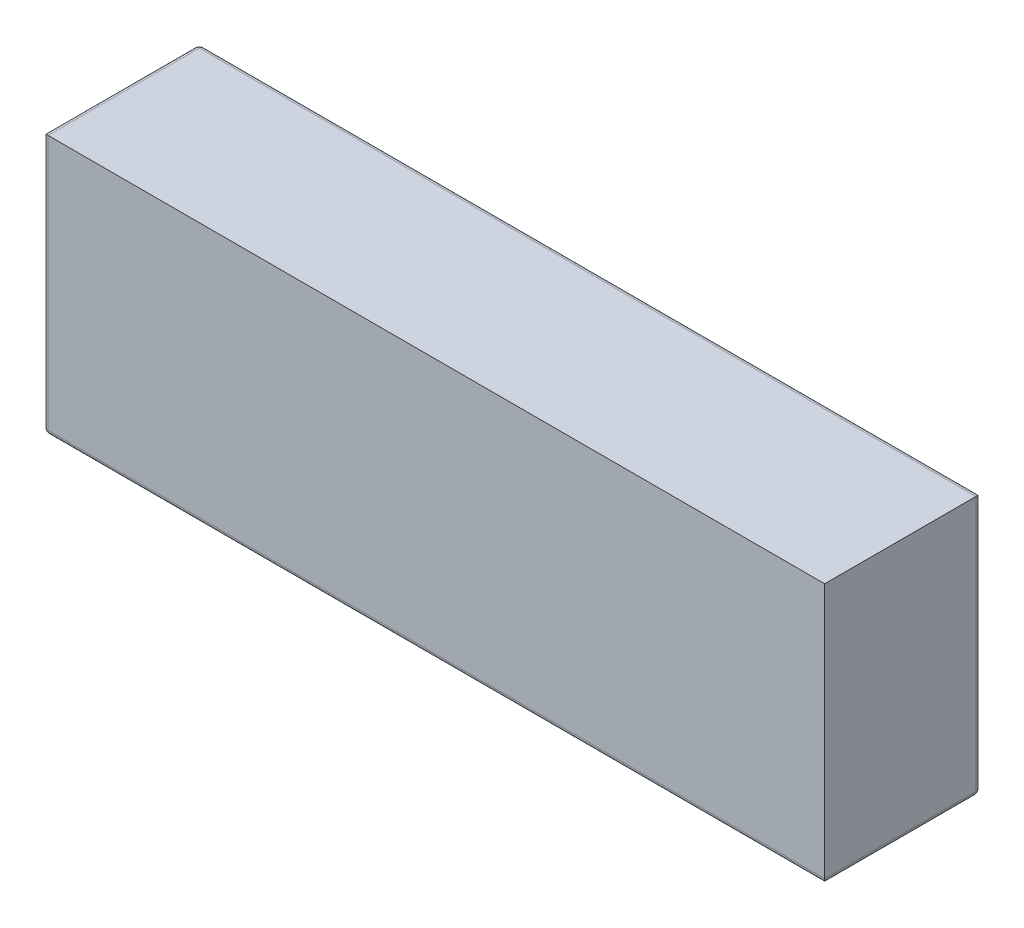
from build123d import *

# Parameters (mm, degrees)
SKETCH1_W           = 150
SKETCH1_H           = 50
BOSS_EXTRUDE1_DEPTH = 28
SKETCH3_W           = 150
SKETCH3_H           = 50
BOSS_EXTRUDE2_DEPTH = 1
SKETCH4_W           = 150
SKETCH4_H           = 50
BOSS_EXTRUDE3_DEPTH = 1
FILLET1_R           = 1


with BuildPart() as part:
    # Sketch1 → Boss-Extrude1 (new body)
    with BuildSketch(Plane.XY):
        Rectangle(SKETCH1_W, SKETCH1_H)
    extrude(amount=BOSS_EXTRUDE1_DEPTH)

    # Sketch3 → Boss-Extrude2 (add)
    with BuildSketch(Plane.XY.offset(28)):
        Rectangle(SKETCH3_W, SKETCH3_H)
    extrude(amount=BOSS_EXTRUDE2_DEPTH)

    # Sketch4 → Boss-Extrude3 (add)
    with BuildSketch(Plane(origin=(0, 0, 0), x_dir=(-1, 0, 0), z_dir=(0, 0, -1))):
        Rectangle(SKETCH4_W, SKETCH4_H)
    extrude(amount=BOSS_EXTRUDE3_DEPTH)

    # Fillet1
    fillet1_edges = [part.edges().sort_by_distance(p)[0] for p in [
        (-75, 0, 29),
        (0, -25, 29),
        (-75, 0, -1),
        (0, 25, -1),
        (75, 0, -1),
        (0, -25, -1),
        (75, -25, 14),
        (-75, -25, 14),
        (-75, 25, 14),
    ]]
    fillet(fillet1_edges, radius=FILLET1_R)


solid = part.part
